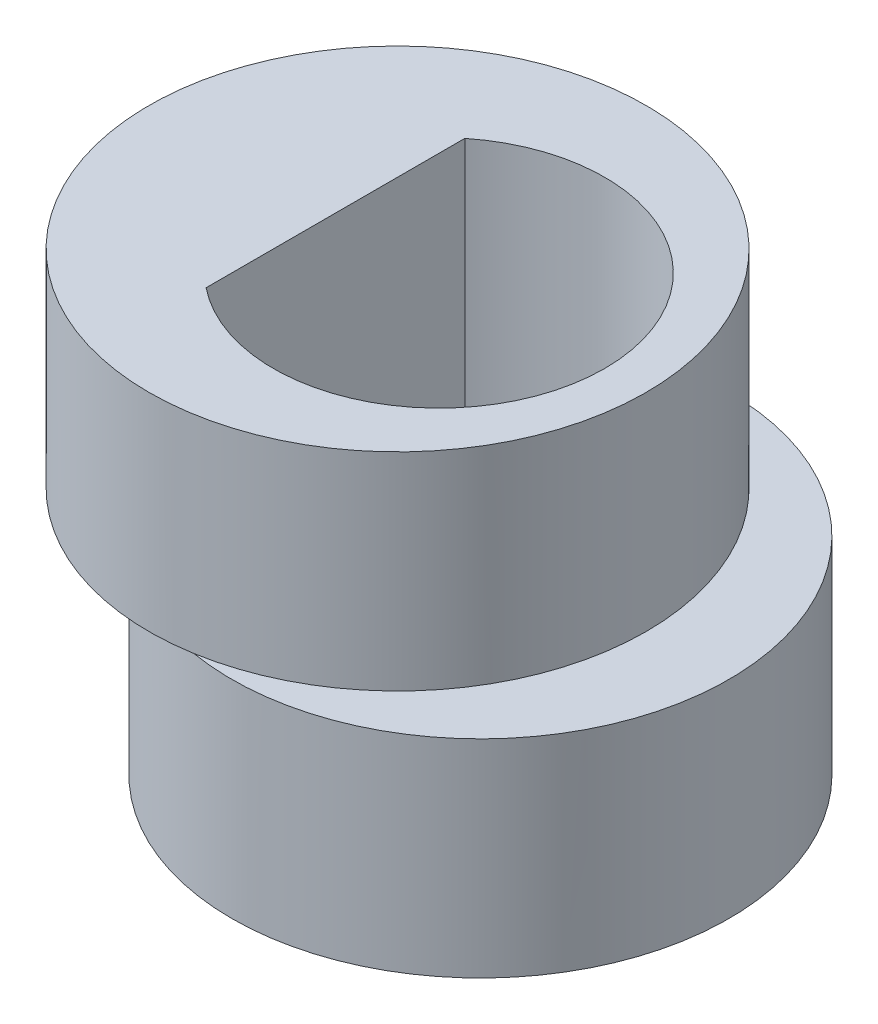
from build123d import *

# Parameters (mm, degrees)
SKETCH1_R           = 6
SKETCH1_R_2         = 4
BOSS_EXTRUDE1_DEPTH = 5
SKETCH2_R           = 6
SKETCH2_R_2         = 4
BOSS_EXTRUDE2_DEPTH = 5
BOSS_EXTRUDE3_DEPTH = 10


with BuildPart() as part:
    # Sketch1 → Boss-Extrude1 (new body)
    with BuildSketch(Plane(origin=(0, 0, 0), x_dir=(1, 0, 0), z_dir=(0, 1, 0))):
        with Locations(Location((1, 0, 0), (0, 0, 270))):
            Circle(SKETCH1_R)
        with Locations(Location((0, 0, 0), (0, 0, 270))):
            Circle(SKETCH1_R_2, mode=Mode.SUBTRACT)
    extrude(amount=BOSS_EXTRUDE1_DEPTH)

    # Sketch2 → Boss-Extrude2 (add)
    with BuildSketch(Plane(origin=(0, 5, 0), x_dir=(1, 0, 0), z_dir=(0, 1, 0))):
        with Locations(Location((-1, 0, 0), (0, 0, 80.405931773))):
            Circle(SKETCH2_R)
        with Locations(Location((0, 0, 0), (0, 0, 270))):
            Circle(SKETCH2_R_2, mode=Mode.SUBTRACT)
    extrude(amount=BOSS_EXTRUDE2_DEPTH)

    # Sketch3 → Boss-Extrude3 (add)
    with BuildSketch(Plane(origin=(0, 0, 0), x_dir=(1, 0, 0), z_dir=(0, 1, 0))):
        with BuildLine():
            Line((-2.5, 3.122498999), (-2.5, -3.122498999))
            ThreePointArc((-2.5, -3.122498999), (-4, 0), (-2.5, 3.122498999))
        make_face()
    extrude(amount=BOSS_EXTRUDE3_DEPTH)


solid = part.part
